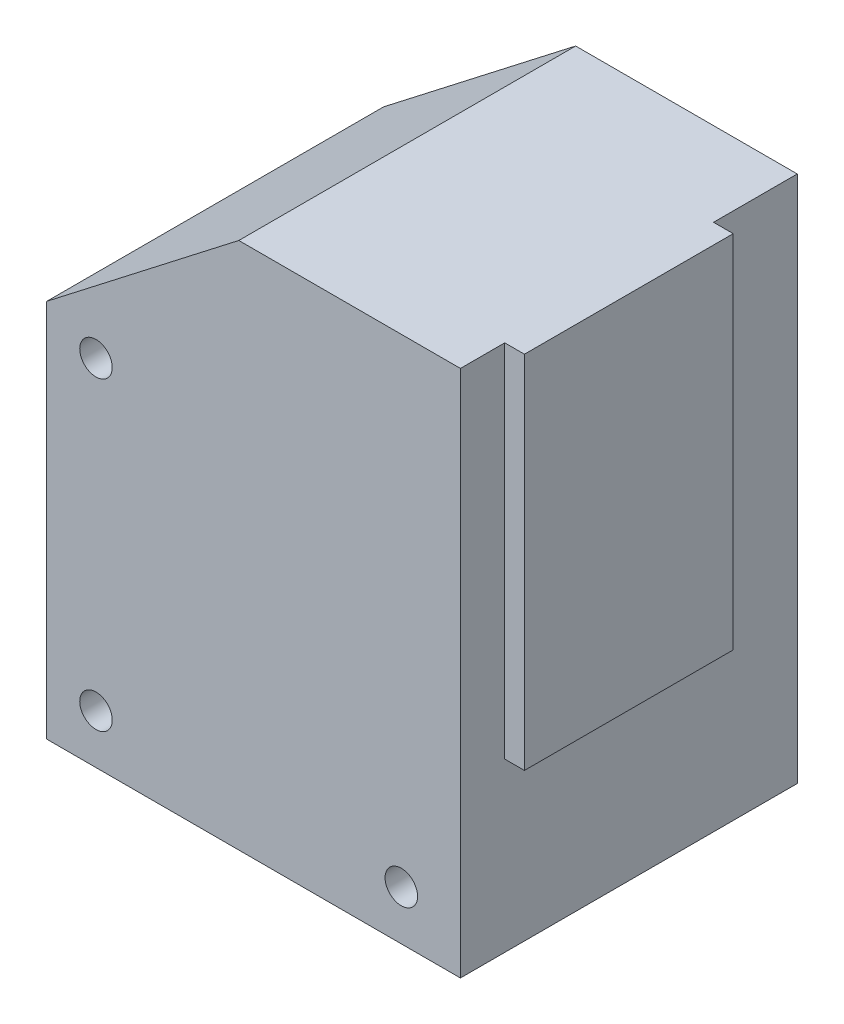
from build123d import *

# Parameters (mm, degrees)
BOSS_EXTRUDE1_DEPTH = 34.2
SKETCH2_R           = 8
CUT_EXTRUDE1_DEPTH  = 10
SKETCH3_W           = 21.2
SKETCH3_H           = 36.6
BOSS_EXTRUDE2_DEPTH = 2
SKETCH5_R           = 1.65
CUT_EXTRUDE4_DEPTH  = 78.321407126


with BuildPart() as part:
    # Sketch1 → Boss-Extrude1 (new body)
    with BuildSketch(Plane.XY):
        Polygon((0, 38.5), (19.5, 53.6), (42, 53.6), (42, 0), (0, 0), align=None)
    extrude(amount=BOSS_EXTRUDE1_DEPTH)

    # Sketch2 → Cut-Extrude1 (cut)
    with BuildSketch(Plane.XZ):
        with Locations(Location((26, 23.7, 0), (0, 0, 270))):
            Circle(SKETCH2_R)
    extrude(amount=-CUT_EXTRUDE1_DEPTH, mode=Mode.SUBTRACT)

    # Sketch3 → Boss-Extrude2 (add)
    with BuildSketch(Plane(origin=(42, 0, 0), x_dir=(0, 0, -1), z_dir=(1, 0, 0))):
        with Locations((-19.1, 35.3)):
            Rectangle(SKETCH3_W, SKETCH3_H)
    extrude(amount=BOSS_EXTRUDE2_DEPTH)

    # Sketch5 → Cut-Extrude4 (cut, through all)
    with BuildSketch(Plane(origin=(0, 0, 0), x_dir=(-1, 0, 0), z_dir=(0, 0, -1))):
        with Locations((-36, 5)):
            Circle(SKETCH5_R)
        with Locations((-5, 5)):
            Circle(SKETCH5_R)
        with Locations((-5, 36)):
            Circle(SKETCH5_R)
    extrude(amount=-CUT_EXTRUDE4_DEPTH, mode=Mode.SUBTRACT)


solid = part.part
